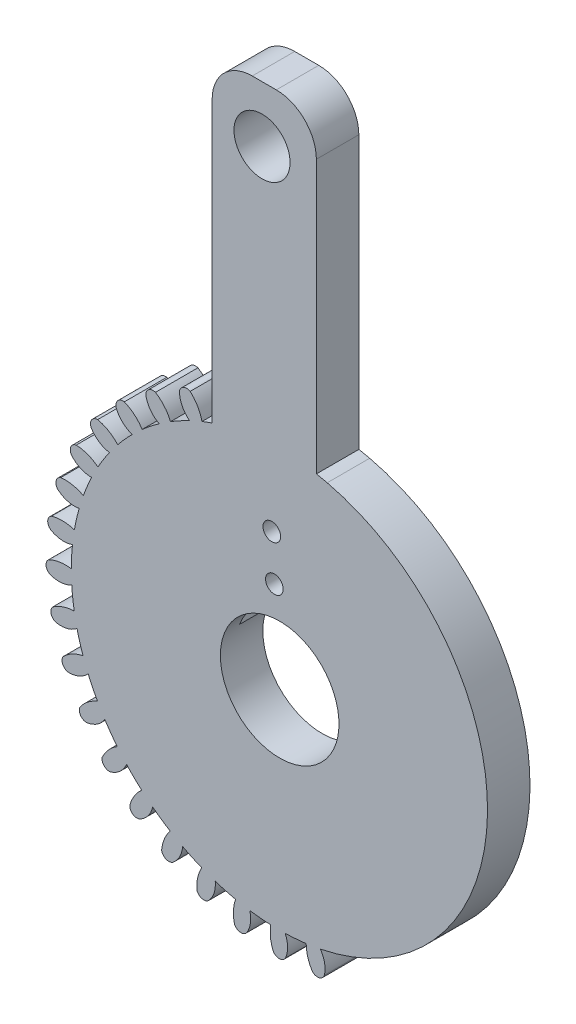
from build123d import *

# Parameters (mm, degrees)
SKETCH1_R           = 13
BOSS_EXTRUDE1_DEPTH = 2.65
BOSS_EXTRUDE2_DEPTH = 2.65
CIRPATTERN1_COUNT   = 37
CUT_EXTRUDE1_DEPTH  = 6
SKETCH5_W           = 6.5
SKETCH5_H           = 20
BOSS_EXTRUDE3_DEPTH = 2.65
FILLET1_R           = 2.5
SKETCH6_R           = 3.7
CUT_EXTRUDE2_DEPTH  = 36.535053909
SKETCH8_R           = 1.75
CUT_EXTRUDE4_DEPTH  = 36.535053909
CUT_EXTRUDE5_DEPTH  = 1.7
SKETCH9_R           = 0.55
CUT_EXTRUDE6_DEPTH  = 36.476859448


with BuildPart() as part:
    # Sketch1 → Boss-Extrude1 (new body)
    with BuildSketch(Plane.XY):
        Circle(SKETCH1_R)
    extrude(amount=BOSS_EXTRUDE1_DEPTH)

    # Sketch2 → Boss-Extrude2 (add)
    with BuildSketch(Plane.XY.offset(2.65)):
        with BuildLine():
            Line((-1.407237761, 12.923609476), (-0.564746485, 12.987727338))
            ThreePointArc((-0.564746485, 12.987727338), (-0.590917928, 13.726605325), (-0.839716114, 14.422827334))
            ThreePointArc((-0.839716114, 14.422827334), (-1.250735375, 14.570045044), (-1.59276063, 14.298699117))
            ThreePointArc((-1.59276063, 14.298699117), (-1.655805876, 13.590133338), (-1.407237761, 12.923609476))
        make_face()
    boss_extrude2 = extrude(amount=-BOSS_EXTRUDE2_DEPTH)

    # CirPattern1: Boss-Extrude2 ×37 about axis
    cirpattern1_axis = Axis((-0.00317711, 0.03890501, 0), (0, 0, 1))
    for i in range(1, CIRPATTERN1_COUNT):
        add(boss_extrude2.rotate(cirpattern1_axis, i * 360 / CIRPATTERN1_COUNT))

    # Sketch3 → Cut-Extrude1 (cut)
    with BuildSketch(Plane.XY.offset(2.65)):
        with BuildLine():
            ThreePointArc((2.539809494, -12.749484999), (12.964979242, -0.216908767), (2.964875647, 12.657389636))
            ThreePointArc((2.964875647, 12.657389636), (2.750073389, 13.993219942), (3.542759924, 15.089682744))
            ThreePointArc((3.542759924, 15.089682744), (15.464629435, -0.258728814), (3.036006853, -15.199747879))
            ThreePointArc((3.036006853, -15.199747879), (3.295374232, -13.871850601), (2.539809494, -12.749484999))
        make_face()
    extrude(amount=-CUT_EXTRUDE1_DEPTH, mode=Mode.SUBTRACT)

    # Sketch5 → Boss-Extrude3 (add)
    with BuildSketch(Plane.XY.offset(2.65)):
        with Locations((-0.96169727, 22.298845722)):
            Rectangle(SKETCH5_W, SKETCH5_H)
    extrude(amount=-BOSS_EXTRUDE3_DEPTH)

    # Fillet1
    fillet1_edges = [part.edges().sort_by_distance(p)[0] for p in [
        (2.28830273, 32.298845722, 1.325),
        (-4.21169727, 32.298845722, 1.325),
    ]]
    fillet(fillet1_edges, radius=FILLET1_R)

    # Sketch6 → Cut-Extrude2 (cut, through all)
    with BuildSketch(Plane(origin=(0, 0, 0), x_dir=(-1, 0, 0), z_dir=(0, 0, -1))):
        Circle(SKETCH6_R)
    extrude(amount=-CUT_EXTRUDE2_DEPTH, mode=Mode.SUBTRACT)

    # Sketch8 → Cut-Extrude4 (cut, through all)
    with BuildSketch(Plane(origin=(0, 0, 0), x_dir=(-1, 0, 0), z_dir=(0, 0, -1))):
        with Locations((1.101176672, 28.798845722)):
            Circle(SKETCH8_R)
    extrude(amount=-CUT_EXTRUDE4_DEPTH, mode=Mode.SUBTRACT)

    # Sketch7 → Cut-Extrude5 (cut)
    with BuildSketch(Plane(origin=(0, 0, 0), x_dir=(-1, 0, 0), z_dir=(0, 0, -1))):
        with BuildLine():
            Line((3.457410227, 1.317692879), (2.9338417, 10.436920645))
            ThreePointArc((2.9338417, 10.436920645), (1.193583976, 12.06013788), (-1.112499205, 11.472505769))
            Line((-1.112499205, 11.472505769), (-2.915695151, 2.277876596))
            ThreePointArc((-2.915695151, 2.277876596), (0.551227719, 3.658708516), (3.457410227, 1.317692879))
        make_face()
    extrude(amount=-CUT_EXTRUDE5_DEPTH, mode=Mode.SUBTRACT)

    # Sketch9 → Cut-Extrude6 (cut, through all)
    with BuildSketch(Plane(origin=(0, 0, 1.7), x_dir=(-1, 0, 0), z_dir=(0, 0, -1))):
        with Locations((0.330807323, 5.53577119)):
            Circle(SKETCH9_R)
        with Locations((0.490803437, 8.294426445)):
            Circle(SKETCH9_R)
    extrude(amount=-CUT_EXTRUDE6_DEPTH, mode=Mode.SUBTRACT)


solid = part.part
